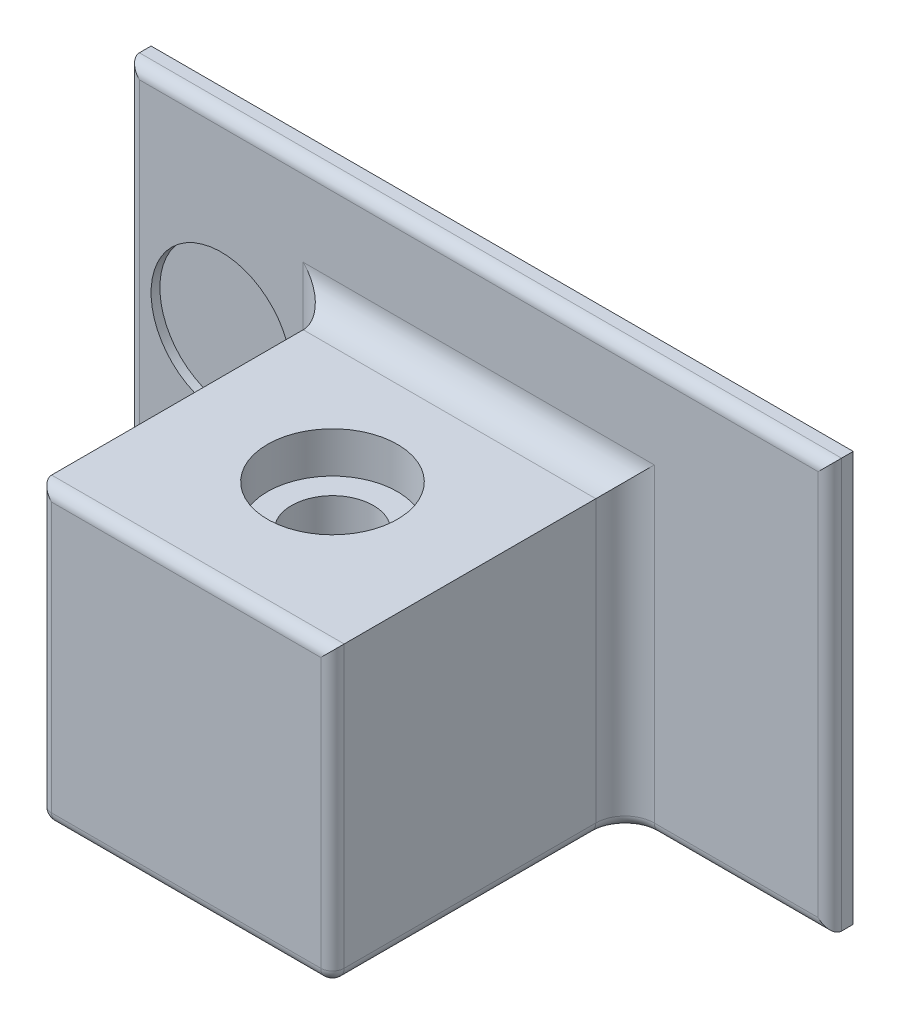
from build123d import *

# Parameters (mm, degrees)
SKETCH1_W           = 70
SKETCH1_H           = 120
BOSS_EXTRUDE1_DEPTH = 4
SKETCH2_W           = 50
SKETCH2_H           = 50
BOSS_EXTRUDE2_DEPTH = 50
SKETCH3_R           = 11.1
CUT_EXTRUDE1_DEPTH  = 7
SKETCH5_R           = 7
CUT_EXTRUDE3_DEPTH  = 103.396288995
CUT_EXTRUDE4_START  = -7
SKETCH6_R           = 11.1
CUT_EXTRUDE4_DEPTH  = 7
SKETCH7_R           = 12
CUT_EXTRUDE5_DEPTH  = 1.5
FILLET1_R           = 5
FILLET2_R           = 2


with BuildPart() as part:
    # Sketch1 → Boss-Extrude1 (new body)
    with BuildSketch(Plane(origin=(0, 0, 0), x_dir=(0, 1, 0), z_dir=(0, 0, 1))):
        Rectangle(SKETCH1_W, SKETCH1_H)
    extrude(amount=BOSS_EXTRUDE1_DEPTH)

    # Sketch2 → Boss-Extrude2 (add)
    with BuildSketch(Plane.XY.offset(4)):
        with Locations((0, -10)):
            Rectangle(SKETCH2_W, SKETCH2_H)
    extrude(amount=BOSS_EXTRUDE2_DEPTH)

    # Sketch3 → Cut-Extrude1 (cut)
    with BuildSketch(Plane.XZ.offset(35)):
        with Locations((0, 29)):
            Circle(SKETCH3_R)
    extrude(amount=-CUT_EXTRUDE1_DEPTH, mode=Mode.SUBTRACT)

    # Sketch5 → Cut-Extrude3 (cut, through all)
    with BuildSketch(Plane.XZ.offset(28)):
        with Locations((0, 29)):
            Circle(SKETCH5_R)
    extrude(amount=-CUT_EXTRUDE3_DEPTH, mode=Mode.SUBTRACT)

    # Sketch6 → Cut-Extrude4 (cut)
    with BuildSketch(Plane(origin=(0, 15, 0), x_dir=(-1, 0, 0), z_dir=(0, 1, 0)).offset(CUT_EXTRUDE4_START)):
        with Locations(Location((0, 29, 0), (0, 0, 180))):
            Circle(SKETCH6_R)
    extrude(amount=CUT_EXTRUDE4_DEPTH, mode=Mode.SUBTRACT)

    # Sketch7 → Cut-Extrude5 (cut)
    with BuildSketch(Plane.XY.offset(4)):
        with Locations((-44, 2.5)):
            Circle(SKETCH7_R)
    extrude(amount=-CUT_EXTRUDE5_DEPTH, mode=Mode.SUBTRACT)

    # Fillet1
    fillet1_edges = [part.edges().sort_by_distance(p)[0] for p in [
        (25, -10, 4),
        (0, 15, 4),
        (-25, -10, 4),
    ]]
    fillet(fillet1_edges, radius=FILLET1_R)

    # Fillet2
    fillet2_edges = [part.edges().sort_by_distance(p)[0] for p in [
        (-45, -35, 4),
        (25, -35, 31.5),
        (60, 0, 4),
        (-25, -35, 31.5),
        (25, -10, 54),
        (0, 15, 54),
        (-25, -10, 54),
        (0, -35, 54),
        (0, 35, 4),
        (45, -35, 4),
        (26.464466094, -35, 5.464466094),
        (-26.464466094, -35, 5.464466094),
        (-60, 0, 4),
    ]]
    fillet(fillet2_edges, radius=FILLET2_R)


solid = part.part
